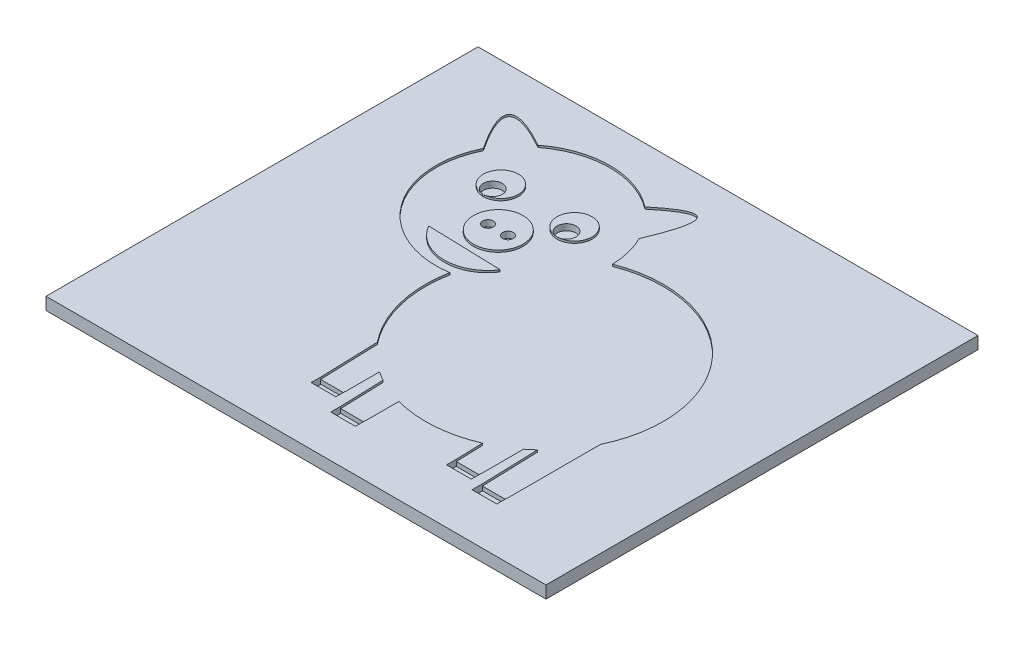
from build123d import *

# Parameters (mm, degrees)
SKETCH1_W           = 128.5875
SKETCH1_H           = 111.125
BOSS_EXTRUDE1_DEPTH = 3.175
SKETCH2_R           = 4.503964563
SKETCH2_R_2         = 6.377074628
CUT_EXTRUDE1_DEPTH  = 0.508
SKETCH4_R           = 2.446965281
SKETCH4_R_2         = 2.441870248
SKETCH4_R_3         = 1.365573368
SKETCH4_R_4         = 1.359710966
SKETCH4_W           = 6.35
SKETCH4_H           = 2.432656747
SKETCH4_H_2         = 2.571304572
SKETCH4_H_3         = 2.507941143
SKETCH4_H_4         = 2.659157088
CUT_EXTRUDE11_DEPTH = 1.5875


with BuildPart() as part:
    # Sketch1 → Boss-Extrude1 (new body)
    with BuildSketch(Plane(origin=(0, 0, 0), x_dir=(1, 0, 0), z_dir=(0, 1, 0))):
        Rectangle(SKETCH1_W, SKETCH1_H)
    extrude(amount=BOSS_EXTRUDE1_DEPTH)

    # Sketch2 → Cut-Extrude1 (cut)
    with BuildSketch(Plane(origin=(0, 3.175, 0), x_dir=(1, 0, 0), z_dir=(0, 1, 0))):
        with BuildLine():
            Line((-11.466221212, -23.168163392), (-10.968659983, -38.249198381))
            Line((-10.968659983, -38.249198381), (-4.570137716, -38.249198381))
            Line((-4.570137716, -38.249198381), (-4.570137716, -29.496558138))
            ThreePointArc((-4.570137716, -29.496558138), (-3.428830963, -30.22282284), (-2.256517086, -30.897894461))
            Line((-2.256517086, -30.897894461), (-1.884638787, -42.169491419))
            Line((-1.884638787, -42.169491419), (4.518768835, -42.169491419))
            Line((4.518768835, -42.169491419), (4.518768835, -33.609716863))
            ThreePointArc((4.518768835, -33.609716863), (14.659430985, -34.563354284), (24.550701184, -32.133286996))
            Line((24.550701184, -32.133286996), (24.780651804, -39.103069122))
            Line((24.780651804, -39.103069122), (31.179561384, -39.103069122))
            Line((31.179561384, -39.103069122), (31.179561384, -28.20870534))
            ThreePointArc((31.179561384, -28.20870534), (32.167865558, -27.406768429), (33.121940536, -26.564397437))
            Line((33.121940536, -26.564397437), (33.604851579, -41.201386667))
            Line((33.604851579, -41.201386667), (40.008784891, -41.201386667))
            Line((40.008784891, -41.201386667), (40.008784891, -17.235252664))
            ThreePointArc((40.008784891, -17.235252664), (34.852114754, 16.699623637), (1.416829228, 24.461630995))
            ThreePointArc((1.416829228, 24.461630995), (0.762007357, 29.154919286), (-0.867318981, 33.604755502))
            add(Edge.make_bspline(
                [(-7.184604133, 41.369579914), (7.863520936, 53.974007146), (-0.867318981, 33.604755502)],
                knots=[0, 0, 0, 1, 1, 1], degree=2))
            ThreePointArc((-7.184604133, 41.369579914), (-20.92757631, 46.092568948), (-34.670548488, 41.369579914))
            add(Edge.make_bspline(
                [(-40.987833639, 33.604755502), (-52.791869615, 51.393160856), (-34.670548488, 41.369579914)],
                knots=[0, 0, 0, 1, 1, 1], degree=2))
            ThreePointArc((-40.987833639, 33.604755502), (-38.980914938, 10.550215331), (-17.629643976, 1.624814864))
            ThreePointArc((-17.629643976, 1.624814864), (-17.261411086, -11.446232799), (-11.466221212, -23.168163392))
        make_face()
        with Locations((-11.797256967, 27.886542178)):
            Circle(SKETCH2_R, mode=Mode.SUBTRACT)
        with Locations((-30.749586512, 27.886542178)):
            Circle(SKETCH2_R, mode=Mode.SUBTRACT)
        with BuildLine():
            ThreePointArc((-11.797256967, 8.766728526), (-21.427716956, 3.728530924), (-30.749586512, 9.317085534))
            Line((-30.749586512, 9.317085534), (-11.797256967, 8.766728526))
        make_face(mode=Mode.SUBTRACT)
        with Locations((-20.92757631, 17.39779757)):
            Circle(SKETCH2_R_2, mode=Mode.SUBTRACT)
    extrude(amount=-CUT_EXTRUDE1_DEPTH, mode=Mode.SUBTRACT)

    # Sketch4 → Cut-Extrude11 (cut)
    with BuildSketch(Plane(origin=(0, 3.175, 0), x_dir=(1, 0, 0), z_dir=(0, 1, 0))):
        with Locations((-30.774197511, 25.825339041)):
            Circle(SKETCH4_R)
        with Locations((-11.798514882, 25.825339041)):
            Circle(SKETCH4_R_2)
        with Locations((-18.425247422, 17.392416095)):
            Circle(SKETCH4_R_3)
        with Locations((-23.55125419, 17.392416095)):
            Circle(SKETCH4_R_4)
        with Locations((-7.793659983, -39.465526755)):
            Rectangle(SKETCH4_W, SKETCH4_H)
        with Locations((1.290361213, -43.455143705)):
            Rectangle(SKETCH4_W, SKETCH4_H_2)
        with Locations((27.955651804, -40.357039693)):
            Rectangle(SKETCH4_W, SKETCH4_H_3)
        with Locations((36.779851579, -42.530965211)):
            Rectangle(SKETCH4_W, SKETCH4_H_4)
    extrude(amount=-CUT_EXTRUDE11_DEPTH, mode=Mode.SUBTRACT)


solid = part.part
